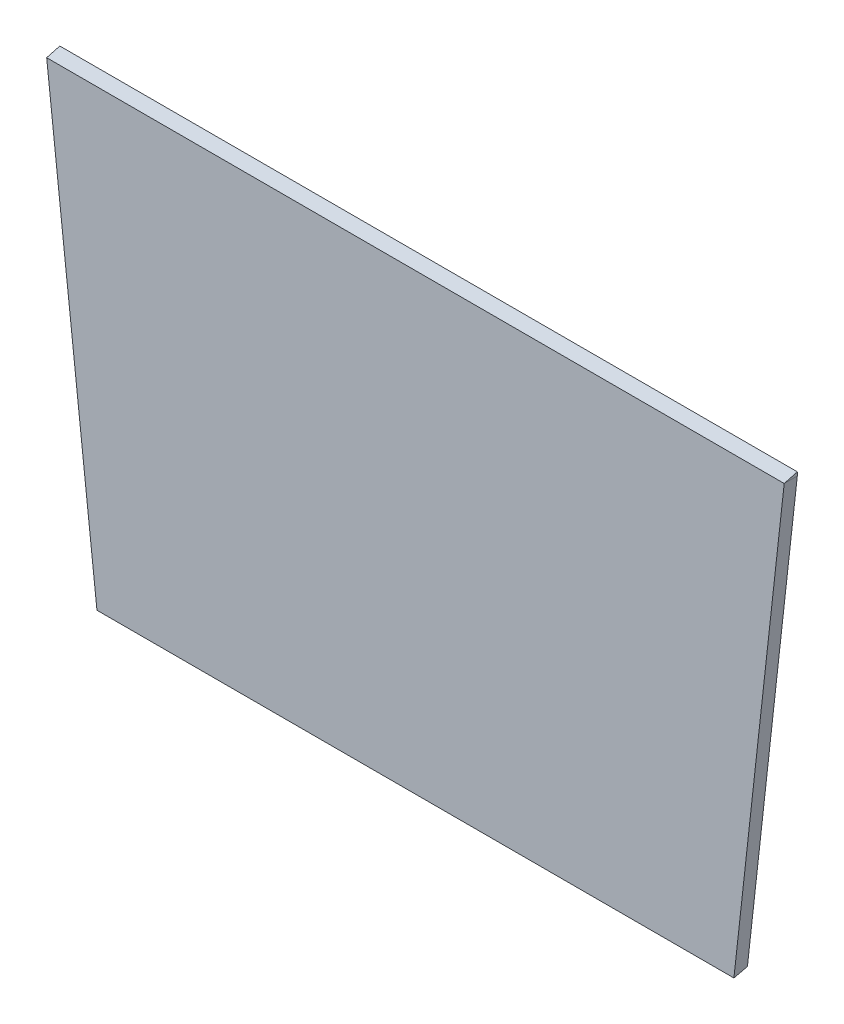
from build123d import *

# Parameters (mm, degrees)
BOSS_EXTRU_1_DEPTH           = 30
BOSS_EXTRU_2_DEPTH           = 970.2413
BOSS_EXTRU_2_DEPTH_BACK      = 715.8287
ENL_V_MAT_EXTRU_1_DEPTH      = 970.2413
ENL_V_MAT_EXTRU_1_DEPTH_BACK = 970.2413


with BuildPart() as part:
    # Esquisse1 → Boss.-Extru.1 (new body)
    with BuildSketch(Plane.XY):
        Polygon((-715.828706454, 477.703685082), (970.241293546, 477.703685082), (855.251293546, -558.817416632), (-600.838706454, -558.817416632), align=None)
    extrude(amount=BOSS_EXTRU_1_DEPTH)

    # Esquisse2 → Boss.-Extru.2 (add, two sides: drawn at the far end of the back side and taken through both)
    with BuildSketch(Plane(origin=(0, 0, 0), x_dir=(0, 0, -1), z_dir=(1, 0, 0)).offset(-BOSS_EXTRU_2_DEPTH_BACK)):
        Polygon((-30, 477.703685082), (0, 477.703685082), (0, 485.832018962), align=None)
    extrude(amount=BOSS_EXTRU_2_DEPTH + BOSS_EXTRU_2_DEPTH_BACK)

    # Esquisse3 → Enlèv. mat.-Extru.1 (cut, two sides: drawn at the far end of the back side and taken through both)
    with BuildSketch(Plane(origin=(0, 0, 0), x_dir=(0, 0, -1), z_dir=(1, 0, 0)).offset(-ENL_V_MAT_EXTRU_1_DEPTH_BACK)):
        Polygon((-30, -558.817416632), (0, -550.689082753), (0, -558.817416632), align=None)
    extrude(amount=ENL_V_MAT_EXTRU_1_DEPTH + ENL_V_MAT_EXTRU_1_DEPTH_BACK, mode=Mode.SUBTRACT)


solid = part.part
